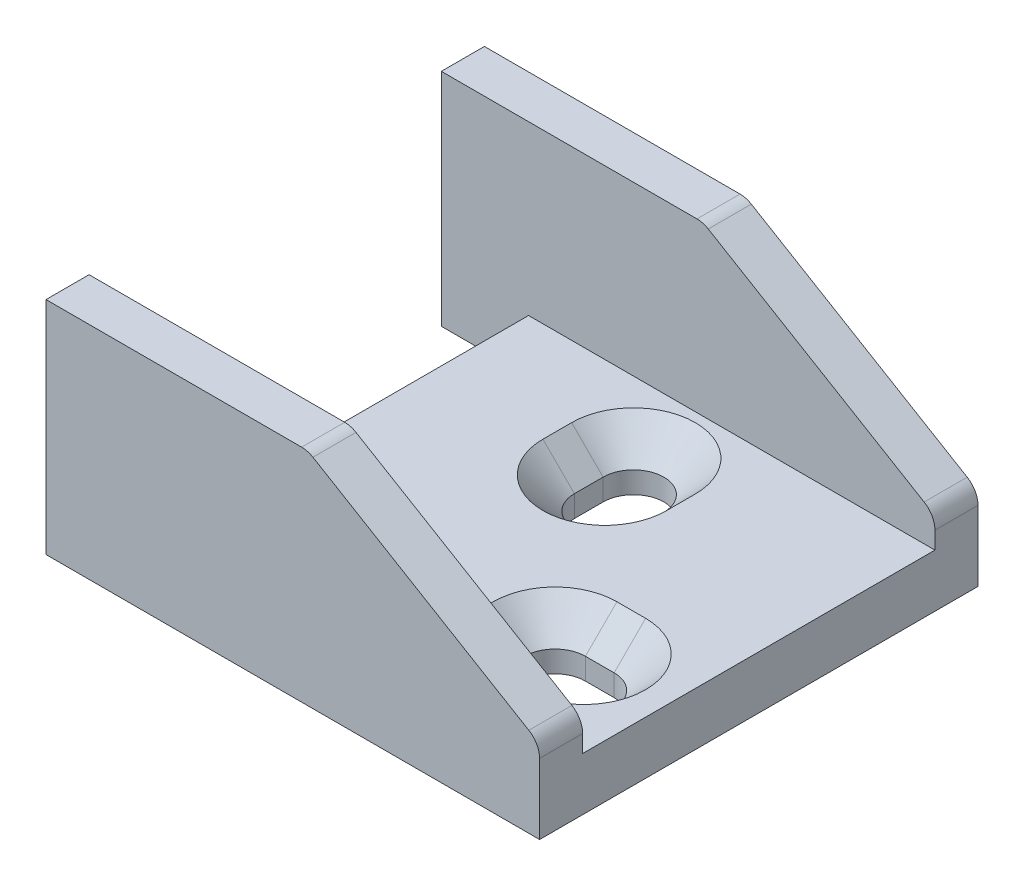
from build123d import *

# Parameters (mm, degrees)
SKETCH1_W           = 36.8
SKETCH1_H           = 39.7
BOSS_EXTRUDE1_DEPTH = 4.8
SKETCH2_W           = 44.7
SKETCH2_H           = 3.9
BOSS_EXTRUDE2_DEPTH = 20
CUT_EXTRUDE1_REACH  = 58.226
CHAMFER1_SIZE       = 2.85
CUT_EXTRUDE2_DEPTH  = 58.709011428
FILLET1_R           = 2


with BuildPart() as part:
    # Sketch1 → Boss-Extrude1 (new body)
    with BuildSketch(Plane(origin=(0, 0, 0), x_dir=(1, 0, 0), z_dir=(0, 1, 0))):
        with Locations((18.4, 19.85)):
            Rectangle(SKETCH1_W, SKETCH1_H)
    extrude(amount=BOSS_EXTRUDE1_DEPTH)

    # Sketch2 → Boss-Extrude2 (add)
    with BuildSketch(Plane(origin=(0, 0, 0), x_dir=(1, 0, 0), z_dir=(0, 1, 0))):
        with Locations((14.45, 37.75)):
            Rectangle(SKETCH2_W, SKETCH2_H)
        with Locations((14.45, 1.95)):
            Rectangle(SKETCH2_W, SKETCH2_H)
    extrude(amount=BOSS_EXTRUDE2_DEPTH)

    # Sketch3 → Cut-Extrude1 (cut, up to next)
    with BuildSketch(Plane(origin=(0, 4.8, 0), x_dir=(1, 0, 0), z_dir=(0, 1, 0)), mode=Mode.PRIVATE) as cut_extrude1_sk1:
        with BuildLine():
            Line((26.45, 14.5), (29.05, 14.5))
            ThreePointArc((29.05, 14.5), (31.8, 11.75), (29.05, 9))
            Line((29.05, 9), (26.45, 9))
            ThreePointArc((26.45, 9), (23.7, 11.75), (26.45, 14.5))
        make_face()
    cut_extrude1_tool1 = extrude(cut_extrude1_sk1.sketch, amount=-CUT_EXTRUDE1_REACH, mode=Mode.PRIVATE) & part.part
    # Sketch3 → Cut-Extrude1 (cut, up to next)
    with BuildSketch(Plane(origin=(0, 4.8, 0), x_dir=(1, 0, 0), z_dir=(0, 1, 0)), mode=Mode.PRIVATE) as cut_extrude1_sk2:
        with BuildLine():
            Line((18.7, 29.35), (18.7, 26.75))
            ThreePointArc((18.7, 26.75), (15.95, 24), (13.2, 26.75))
            Line((13.2, 26.75), (13.2, 29.35))
            ThreePointArc((13.2, 29.35), (15.95, 32.1), (18.7, 29.35))
        make_face()
    cut_extrude1_tool2 = extrude(cut_extrude1_sk2.sketch, amount=-CUT_EXTRUDE1_REACH, mode=Mode.PRIVATE) & part.part
    add(cut_extrude1_tool1.solids().sort_by_distance((27.75, 4.8, -11.75))[0], mode=Mode.SUBTRACT)
    add(cut_extrude1_tool2.solids().sort_by_distance((15.95, 4.8, -28.05))[0], mode=Mode.SUBTRACT)

    # Chamfer1
    chamfer1_edges = [part.edges().sort_by_distance(p)[0] for p in [
        (23.7, 4.8, -11.75),
        (27.75, 4.8, -9),
        (31.8, 4.8, -11.75),
        (27.75, 4.8, -14.5),
        (15.95, 4.8, -32.1),
        (13.2, 4.8, -28.05),
        (15.95, 4.8, -24),
        (18.7, 4.8, -28.05),
    ]]
    chamfer(chamfer1_edges, length=CHAMFER1_SIZE)

    # Sketch4 → Cut-Extrude2 (cut, through all)
    with BuildSketch(Plane(origin=(0, 0, -39.7), x_dir=(-1, 0, 0), z_dir=(0, 0, -1))):
        Polygon((-36.8, 20), (-36.8, 7.5), (-15.8, 20), align=None)
    extrude(amount=-CUT_EXTRUDE2_DEPTH, mode=Mode.SUBTRACT)

    # Fillet1
    fillet1_edges = [part.edges().sort_by_distance(p)[0] for p in [
        (15.8, 20, -37.75),
        (15.8, 20, -1.95),
        (36.8, 7.5, -37.75),
        (36.8, 7.5, -1.95),
    ]]
    fillet(fillet1_edges, radius=FILLET1_R)


solid = part.part
